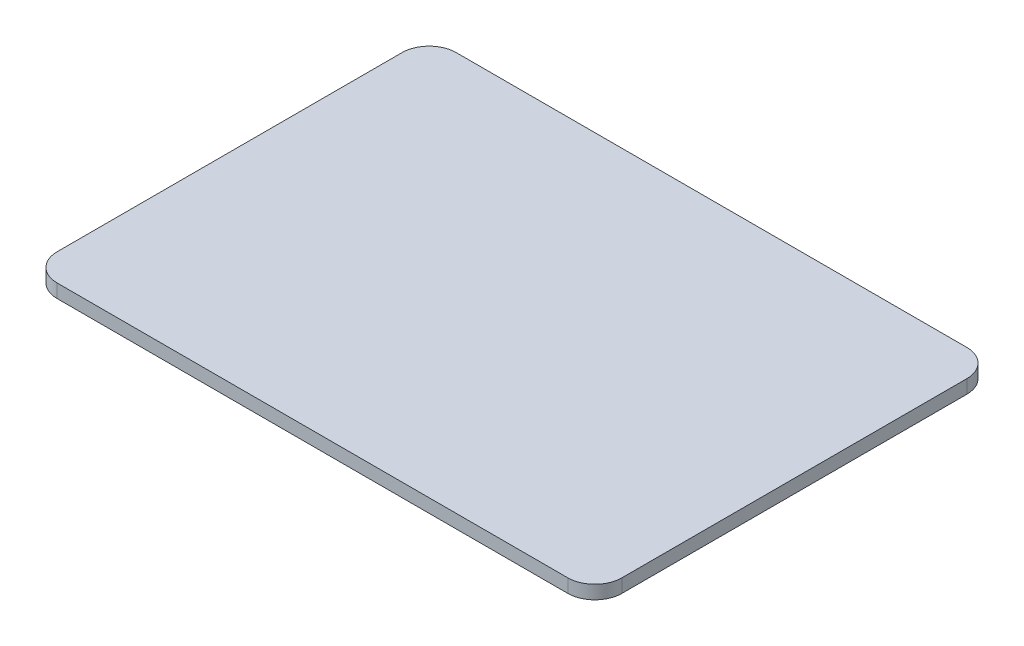
from build123d import *

# Parameters (mm, degrees)
SKETCH1_W           = 265.1125
SKETCH1_H           = 187.325
BOSS_EXTRUDE1_DEPTH = 6.35
FILLET1_R           = 12.7


with BuildPart() as part:
    # Sketch1 → Boss-Extrude1 (new body)
    with BuildSketch(Plane(origin=(0, 0, 0), x_dir=(1, 0, 0), z_dir=(0, 1, 0))):
        Rectangle(SKETCH1_W, SKETCH1_H)
    extrude(amount=BOSS_EXTRUDE1_DEPTH)

    # Fillet1
    fillet1_edges = [part.edges().sort_by_distance(p)[0] for p in [
        (132.55625, 3.175, 93.6625),
        (-132.55625, 3.175, 93.6625),
        (-132.55625, 3.175, -93.6625),
        (132.55625, 3.175, -93.6625),
    ]]
    fillet(fillet1_edges, radius=FILLET1_R)


solid = part.part
